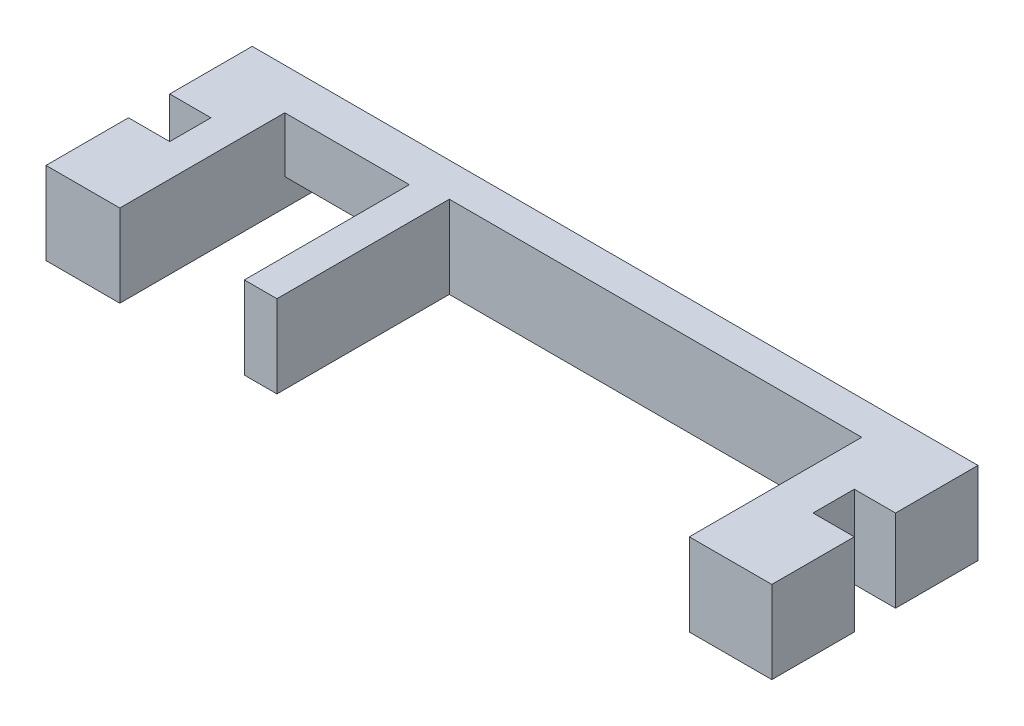
from build123d import *

# Parameters (mm, degrees)
SKETCH1_W           = 98
SKETCH1_H           = 25
BOSS_EXTRUDE1_DEPTH = 10
SKETCH4_W           = 25
SKETCH4_H           = 10
CUT_EXTRUDE6_DEPTH  = 5
SKETCH5_W           = 25
SKETCH5_H           = 10
CUT_EXTRUDE7_DEPTH  = 5
SKETCH6_W           = 5
SKETCH6_H           = 10
CUT_EXTRUDE8_DEPTH  = 5
SKETCH7_W           = 5
SKETCH7_H           = 10
CUT_EXTRUDE9_DEPTH  = 5
SKETCH8_W           = 50
SKETCH8_H           = 20.9
CUT_EXTRUDE10_DEPTH = 13
SKETCH9_W           = 15.1
SKETCH9_H           = 7.5
SKETCH9_H_2         = 12.5
CUT_EXTRUDE11_DEPTH = 13
SKETCH10_W          = 15.1
SKETCH10_H          = 5
CUT_EXTRUDE12_DEPTH = 3.3


with BuildPart() as part:
    # Sketch1 → Boss-Extrude1 (new body)
    with BuildSketch(Plane(origin=(0, 0, 0), x_dir=(1, 0, 0), z_dir=(0, 1, 0))):
        Rectangle(SKETCH1_W, SKETCH1_H)
    extrude(amount=BOSS_EXTRUDE1_DEPTH)

    # Sketch4 → Cut-Extrude6 (cut)
    with BuildSketch(Plane.ZY.offset(49)):
        with Locations((0, 5)):
            Rectangle(SKETCH4_W, SKETCH4_H)
    extrude(amount=-CUT_EXTRUDE6_DEPTH, mode=Mode.SUBTRACT)

    # Sketch5 → Cut-Extrude7 (cut)
    with BuildSketch(Plane(origin=(49, 0, 0), x_dir=(0, 0, -1), z_dir=(1, 0, 0))):
        with Locations((0, 5)):
            Rectangle(SKETCH5_W, SKETCH5_H)
    extrude(amount=-CUT_EXTRUDE7_DEPTH, mode=Mode.SUBTRACT)

    # Sketch6 → Cut-Extrude8 (cut)
    with BuildSketch(Plane(origin=(44, 0, 0), x_dir=(0, 0, -1), z_dir=(1, 0, 0))):
        with Locations((0, 5)):
            Rectangle(SKETCH6_W, SKETCH6_H)
    extrude(amount=-CUT_EXTRUDE8_DEPTH, mode=Mode.SUBTRACT)

    # Sketch7 → Cut-Extrude9 (cut)
    with BuildSketch(Plane.ZY.offset(44)):
        with Locations((0, 5)):
            Rectangle(SKETCH7_W, SKETCH7_H)
    extrude(amount=-CUT_EXTRUDE9_DEPTH, mode=Mode.SUBTRACT)

    # Sketch8 → Cut-Extrude10 (cut)
    with BuildSketch(Plane(origin=(0, 10, 0), x_dir=(1, 0, 0), z_dir=(0, 1, 0))):
        with Locations((9, -2.05)):
            Rectangle(SKETCH8_W, SKETCH8_H)
    extrude(amount=-CUT_EXTRUDE10_DEPTH, mode=Mode.SUBTRACT)

    # Sketch9 → Cut-Extrude11 (cut)
    with BuildSketch(Plane(origin=(0, 10, 0), x_dir=(1, 0, 0), z_dir=(0, 1, 0))):
        with Locations((-27.5, 3.75)):
            Rectangle(SKETCH9_W, SKETCH9_H)
        with Locations((-27.5, -6.25)):
            Rectangle(SKETCH9_W, SKETCH9_H_2)
    extrude(amount=-CUT_EXTRUDE11_DEPTH, mode=Mode.SUBTRACT)

    # Sketch10 → Cut-Extrude12 (cut)
    with BuildSketch(Plane.XZ):
        with Locations((-27.5, -10)):
            Rectangle(SKETCH10_W, SKETCH10_H)
    extrude(amount=-CUT_EXTRUDE12_DEPTH, mode=Mode.SUBTRACT)


solid = part.part
